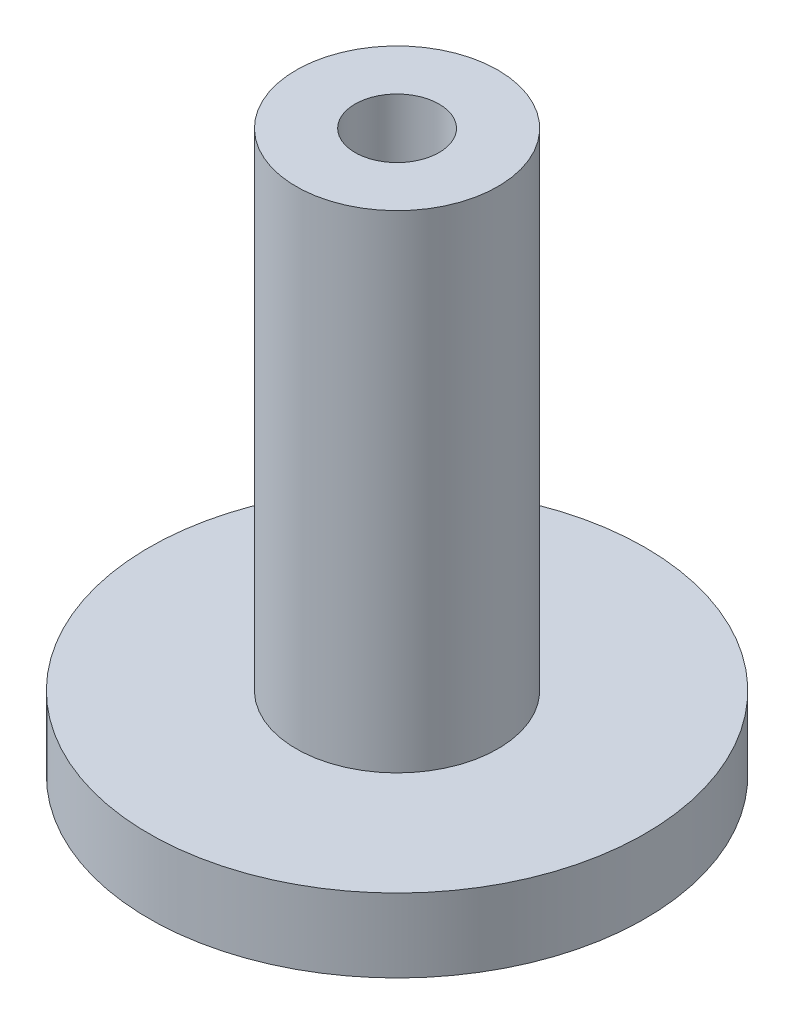
from build123d import *


with BuildPart() as part:
    # Sketch1 → Revolve1 (revolve)
    with BuildSketch(Plane.XY, mode=Mode.PRIVATE) as revolve1_sk:
        Polygon((-1.143, 0), (-1.143, 15.24), (-2.743, 15.24), (-2.743, 2), (-6.743, 2), (-6.743, 0), align=None)
    revolve(revolve1_sk.sketch.rotate(Axis((0, 0, 0), (0, 1, 0)), 270), axis=Axis((0, 0, 0), (0, 1, 0)))


solid = part.part
